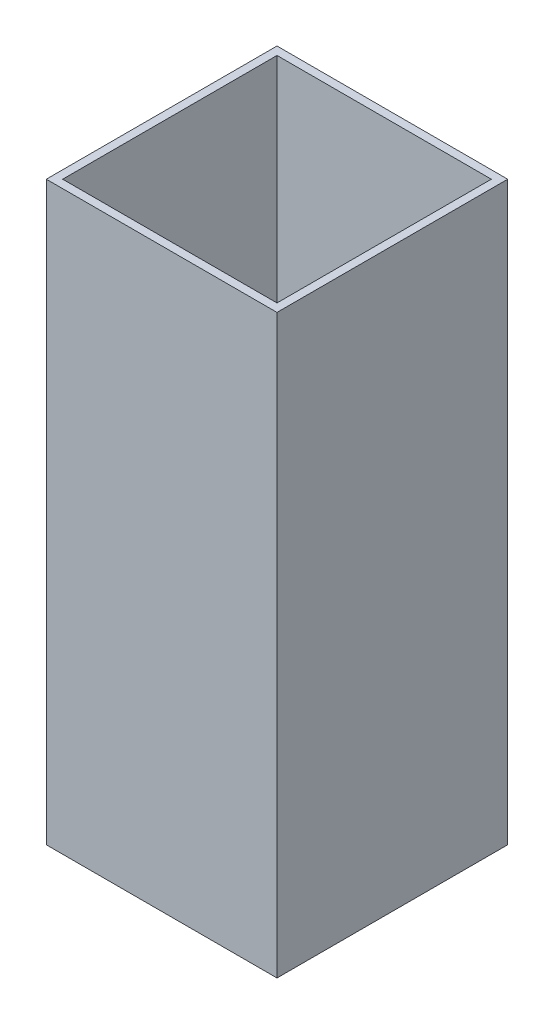
from build123d import *

# Parameters (mm, degrees)
SKETCH1_W           = 101.5
SKETCH1_H           = 101.5
BOSS_EXTRUDE1_DEPTH = 3.6
SKETCH2_W           = 101.5
SKETCH2_H           = 101.5
SKETCH2_W_2         = 94.3
SKETCH2_H_2         = 94.3
BOSS_EXTRUDE2_DEPTH = 250


with BuildPart() as part:
    # Sketch1 → Boss-Extrude1 (new body)
    with BuildSketch(Plane(origin=(0, 0, 0), x_dir=(1, 0, 0), z_dir=(0, 1, 0))):
        Rectangle(SKETCH1_W, SKETCH1_H)
    extrude(amount=BOSS_EXTRUDE1_DEPTH)

    # Sketch2 → Boss-Extrude2 (add)
    with BuildSketch(Plane(origin=(0, 3.6, 0), x_dir=(1, 0, 0), z_dir=(0, 1, 0))):
        Rectangle(SKETCH2_W, SKETCH2_H)
        Rectangle(SKETCH2_W_2, SKETCH2_H_2, mode=Mode.SUBTRACT)
    extrude(amount=BOSS_EXTRUDE2_DEPTH)


solid = part.part
